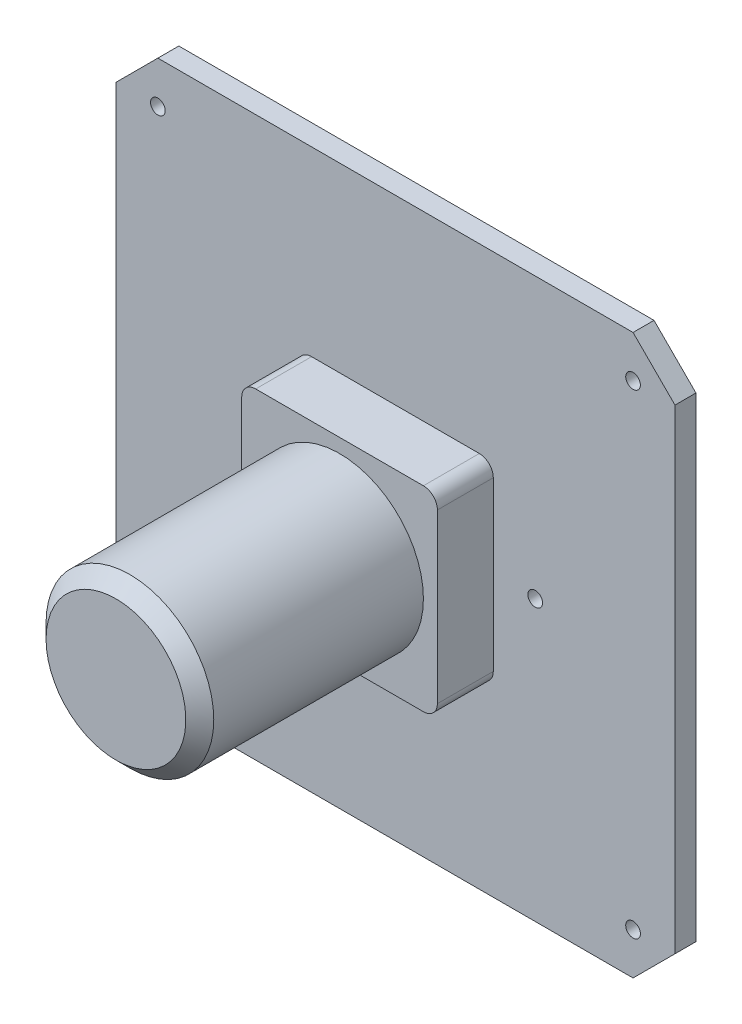
from build123d import *

# Parameters (mm, degrees)
SKETCH1_R           = 0.525
BOSS_EXTRUDE1_DEPTH = 1.5
BOSS_EXTRUDE2_DEPTH = 4
SKETCH4_W           = 6
SKETCH4_H           = 16
CHAMFER1_SIZE       = 1


with BuildPart() as part:
    # Sketch1 → Boss-Extrude1 (new body)
    with BuildSketch(Plane.XY):
        Polygon((-20, 17), (-17, 20), (17, 20), (20, 17), (20, -17), (17, -20), (-17, -20), (-20, -17), align=None)
        with Locations((-17, 17)):
            Circle(SKETCH1_R, mode=Mode.SUBTRACT)
        with Locations((17, 17)):
            Circle(SKETCH1_R, mode=Mode.SUBTRACT)
        with Locations((17, -17)):
            Circle(SKETCH1_R, mode=Mode.SUBTRACT)
        with Locations((-17, -17)):
            Circle(SKETCH1_R, mode=Mode.SUBTRACT)
        with Locations((10, 0)):
            Circle(SKETCH1_R, mode=Mode.SUBTRACT)
        with Locations((-10, 0)):
            Circle(SKETCH1_R, mode=Mode.SUBTRACT)
    extrude(amount=BOSS_EXTRUDE1_DEPTH)

    # Sketch3 → Boss-Extrude2 (add)
    with BuildSketch(Plane.XY.offset(1.5)):
        with BuildLine():
            Line((-6, -7), (6, -7))
            ThreePointArc((6, -7), (6.707106781, -6.707106781), (7, -6))
            Line((7, -6), (7, 6))
            ThreePointArc((7, 6), (6.707106781, 6.707106781), (6, 7))
            Line((6, 7), (-6, 7))
            ThreePointArc((-6, 7), (-6.707106781, 6.707106781), (-7, 6))
            Line((-7, 6), (-7, -6))
            ThreePointArc((-7, -6), (-6.707106781, -6.707106781), (-6, -7))
        make_face()
    extrude(amount=BOSS_EXTRUDE2_DEPTH)

    # Sketch4 → Revolve1 (revolve)
    with BuildSketch(Plane(origin=(0, 0, 0), x_dir=(1, 0, 0), z_dir=(0, 1, 0)), mode=Mode.PRIVATE) as revolve1_sk:
        with Locations((-3, -13.5)):
            Rectangle(SKETCH4_W, SKETCH4_H)
    revolve(revolve1_sk.sketch.rotate(Axis((0, 0, 1000), (0, 0, -1)), 180), axis=Axis((0, 0, 1000), (0, 0, -1)))

    # Chamfer1
    chamfer1_edges = [part.edges().sort_by_distance(p)[0] for p in [
        (-6, 0, 21.5),
    ]]
    chamfer(chamfer1_edges, length=CHAMFER1_SIZE)


solid = part.part
